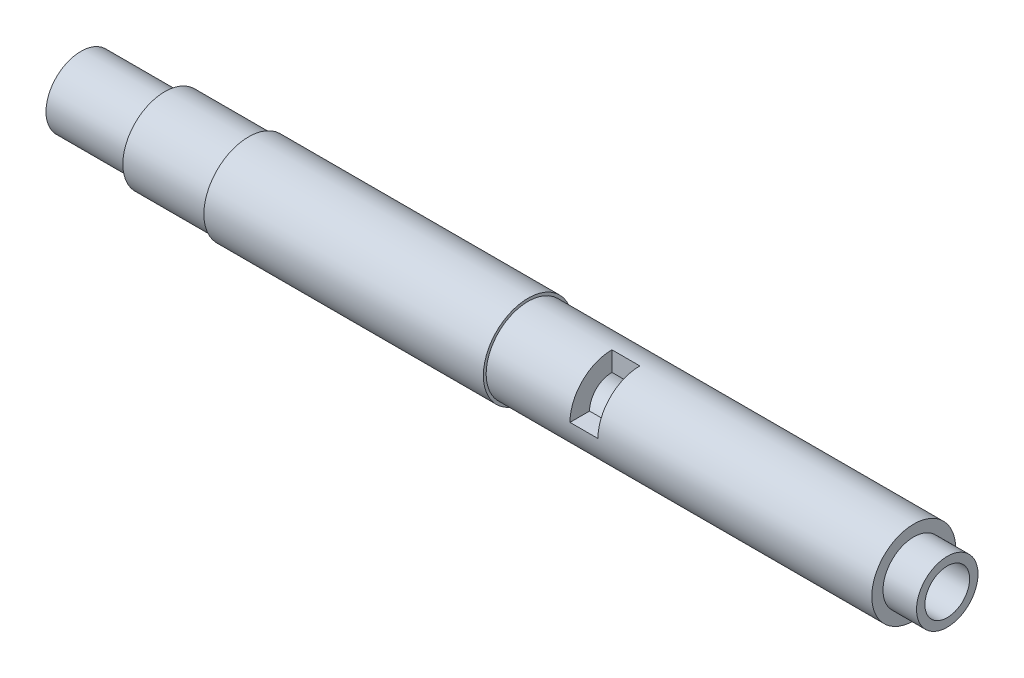
from build123d import *

# Parameters (mm, degrees)
SKETCH_1_R           = 16
EXTRUDE_1_DEPTH      = 100
EXTRUDE_START        = -18
SKETCH_2_R           = 16
EXTRUDE_2_DEPTH      = 18
SKETCH_3_R           = 16
EXTRUDE_3_DEPTH      = 132
SKETCH_4_R           = 16
EXTRUDE_4_DEPTH      = 18
SKETCH_5_R           = 16
EXTRUDE_5_DEPTH      = 50
SKETCH_6_R           = 16
EXTRUDE_6_DEPTH      = 80
SKETCH_7_R           = 16
EXTRUDE_7_DEPTH      = 50
SKETCH_9_R           = 8
EXTRUDE_8_DEPTH      = 20
SKETCH_13_R          = 8
CUT_EXTRUDE_5_DEPTH  = 450
SKETCH_14_R          = 16
SKETCH_14_R_2        = 12.5
CUT_EXTRUDE_6_DEPTH  = 30
SKETCH_16_R          = 16
SKETCH_16_R_2        = 15
CUT_EXTRUDE_8_DEPTH  = 30
SKETCH_17_R          = 16
SKETCH_17_R_2        = 15
CUT_EXTRUDE_9_DEPTH  = 60
CUT_EXTRUDE_START    = -200
SKETCH_18_R          = 16
CUT_EXTRUDE_10_DEPTH = 200
CUT_EXTRUDE_START_2  = -20
SKETCH_19_R          = 16
SKETCH_19_R_2        = 8
CUT_EXTRUDE_11_DEPTH = 20
SKETCH_20_R          = 15
SKETCH_20_R_2        = 8
EXTRUDE_9_DEPTH      = 100
CUT_EXTRUDE_START_3  = -10
CUT_EXTRUDE_12_DEPTH = 10
CUT_EXTRUDE_START_4  = -12
SKETCH_22_R          = 15
SKETCH_22_R_2        = 11
CUT_EXTRUDE_13_DEPTH = 12


with BuildPart() as part:
    # 草图1 → 凸台-拉伸1 (new body)
    with BuildSketch(Plane(origin=(0, 0, 0), x_dir=(0, 0, -1), z_dir=(1, 0, 0))):
        Circle(SKETCH_1_R)
    extrude(amount=EXTRUDE_1_DEPTH)

    # 草图2 → 凸台-拉伸2 (add)
    with BuildSketch(Plane(origin=(100, 0, 0), x_dir=(0, 0, -1), z_dir=(1, 0, 0)).offset(EXTRUDE_START)):
        Circle(SKETCH_2_R)
    extrude(amount=EXTRUDE_2_DEPTH)

    # 草图3 → 凸台-拉伸3 (add)
    with BuildSketch(Plane(origin=(100, 0, 0), x_dir=(0, 0, -1), z_dir=(1, 0, 0))):
        Circle(SKETCH_3_R)
    extrude(amount=EXTRUDE_3_DEPTH)

    # 草图4 → 凸台-拉伸4 (add)
    with BuildSketch(Plane(origin=(232, 0, 0), x_dir=(0, 0, -1), z_dir=(1, 0, 0))):
        Circle(SKETCH_4_R)
    extrude(amount=EXTRUDE_4_DEPTH)

    # 草图5 → 凸台-拉伸5 (add)
    with BuildSketch(Plane(origin=(250, 0, 0), x_dir=(0, 0, -1), z_dir=(1, 0, 0))):
        Circle(SKETCH_5_R)
    extrude(amount=EXTRUDE_5_DEPTH)

    # 草图6 → 凸台-拉伸6 (add)
    with BuildSketch(Plane(origin=(300, 0, 0), x_dir=(0, 0, -1), z_dir=(1, 0, 0))):
        Circle(SKETCH_6_R)
    extrude(amount=EXTRUDE_6_DEPTH)

    # 草图7 → 凸台-拉伸7 (add)
    with BuildSketch(Plane(origin=(380, 0, 0), x_dir=(0, 0, -1), z_dir=(1, 0, 0))):
        Circle(SKETCH_7_R)
    extrude(amount=EXTRUDE_7_DEPTH)

    # 草图9 → 凸台-拉伸8 (add)
    with BuildSketch(Plane(origin=(430, 0, 0), x_dir=(0, 0, -1), z_dir=(1, 0, 0))):
        Circle(SKETCH_9_R)
    extrude(amount=EXTRUDE_8_DEPTH)

    # 草图13 → 切除-拉伸5 (cut)
    with BuildSketch(Plane.ZY):
        Circle(SKETCH_13_R)
    extrude(amount=-CUT_EXTRUDE_5_DEPTH, mode=Mode.SUBTRACT)

    # 草图14 → 切除-拉伸6 (cut)
    with BuildSketch(Plane.ZY):
        Circle(SKETCH_14_R)
        Circle(SKETCH_14_R_2, mode=Mode.SUBTRACT)
    extrude(amount=-CUT_EXTRUDE_6_DEPTH, mode=Mode.SUBTRACT)

    # 草图16 → 切除-拉伸8 (cut)
    with BuildSketch(Plane.ZY.offset(-30)):
        Circle(SKETCH_16_R)
        Circle(SKETCH_16_R_2, mode=Mode.SUBTRACT)
    extrude(amount=-CUT_EXTRUDE_8_DEPTH, mode=Mode.SUBTRACT)

    # 草图17 → 切除-拉伸9 (cut)
    with BuildSketch(Plane.ZY.offset(-160)):
        Circle(SKETCH_17_R)
        Circle(SKETCH_17_R_2, mode=Mode.SUBTRACT)
    extrude(amount=-CUT_EXTRUDE_9_DEPTH, mode=Mode.SUBTRACT)

    # 草图18 → 切除-拉伸10 (cut)
    with BuildSketch(Plane(origin=(430, 0, 0), x_dir=(0, 0, -1), z_dir=(1, 0, 0)).offset(CUT_EXTRUDE_START)):
        with Locations(Location((0, 0, 0), (0, 0, 180))):
            Circle(SKETCH_18_R)
    extrude(amount=CUT_EXTRUDE_10_DEPTH, mode=Mode.SUBTRACT)

    # 草图19 → 切除-拉伸11 (cut)
    with BuildSketch(Plane(origin=(230, 0, 0), x_dir=(0, 0, -1), z_dir=(1, 0, 0)).offset(CUT_EXTRUDE_START_2)):
        with Locations(Location((0, 0, 0), (0, 0, 180))):
            Circle(SKETCH_19_R)
        with Locations(Location((0, 0, 0), (0, 0, 180))):
            Circle(SKETCH_19_R_2, mode=Mode.SUBTRACT)
    extrude(amount=CUT_EXTRUDE_11_DEPTH, mode=Mode.SUBTRACT)

    # 草图20 → 凸台-拉伸9 (add)
    with BuildSketch(Plane(origin=(210, 0, 0), x_dir=(0, 0, -1), z_dir=(1, 0, 0))):
        with Locations(Location((0, 0, 0), (0, 0, 180))):
            Circle(SKETCH_20_R)
        with Locations(Location((0, 0, 0), (0, 0, 180))):
            Circle(SKETCH_20_R_2, mode=Mode.SUBTRACT)
    extrude(amount=EXTRUDE_9_DEPTH)

    # 草图21 → 切除-拉伸12 (cut)
    with BuildSketch(Plane(origin=(200, 0, 0), x_dir=(0, 0, -1), z_dir=(1, 0, 0)).offset(CUT_EXTRUDE_START_3)):
        with BuildLine():
            Line((-15, 0), (-8, 0))
            ThreePointArc((-8, 0), (-5.656854249, 5.656854249), (0, 8))
            Line((0, 8), (0, 15))
            ThreePointArc((0, 15), (-10.606601718, 10.606601718), (-15, 0))
        make_face()
        with BuildLine():
            Line((8, 0), (15, 0))
            ThreePointArc((15, 0), (10.606601718, -10.606601718), (0, -15))
            Line((0, -15), (0, -8))
            ThreePointArc((0, -8), (5.656854249, -5.656854249), (8, 0))
        make_face()
    extrude(amount=CUT_EXTRUDE_12_DEPTH, mode=Mode.SUBTRACT)

    # 草图22 → 切除-拉伸13 (cut)
    with BuildSketch(Plane(origin=(310, 0, 0), x_dir=(0, 0, -1), z_dir=(1, 0, 0)).offset(CUT_EXTRUDE_START_4)):
        with Locations(Location((0, 0, 0), (0, 0, 180))):
            Circle(SKETCH_22_R)
        Circle(SKETCH_22_R_2, mode=Mode.SUBTRACT)
    extrude(amount=CUT_EXTRUDE_13_DEPTH, mode=Mode.SUBTRACT)


solid = part.part
